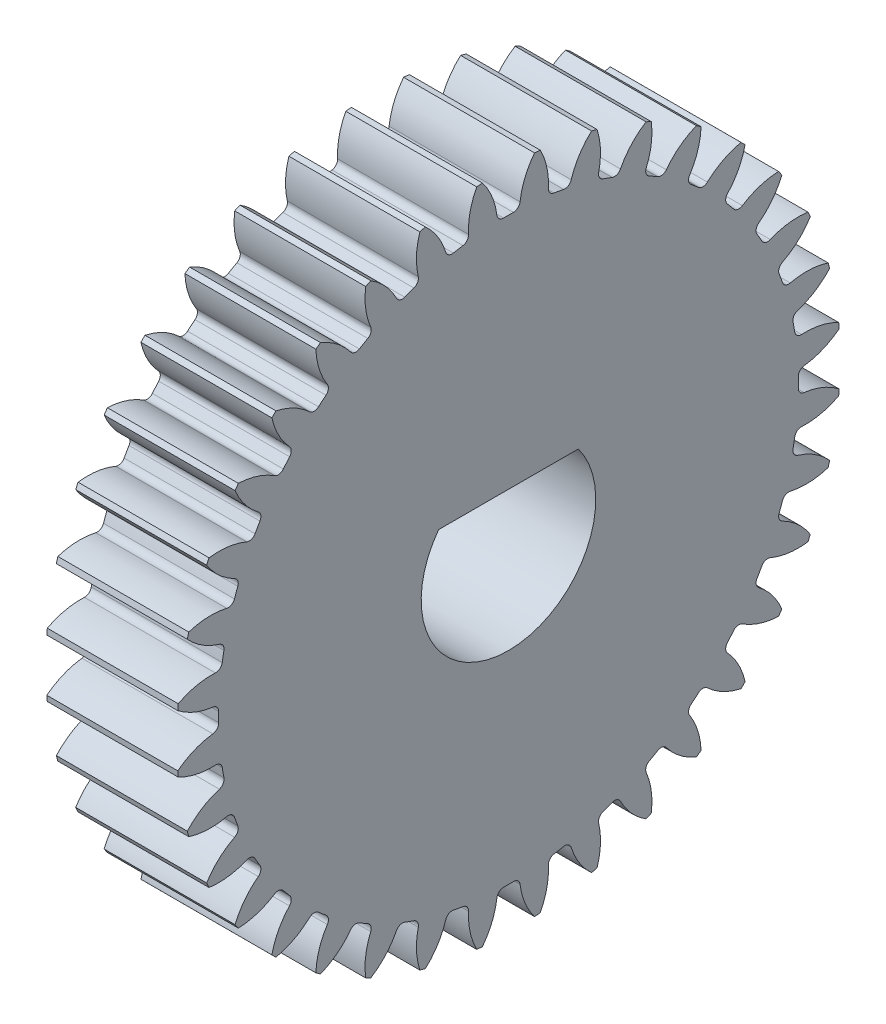
from build123d import *

# Parameters (mm, degrees)
SKETCH1_R                = 19
SKETCH1_R_2              = 5
BOSS_EXTRUDE2_DEPTH      = 7.5
CUT_EXTRUDE1_DEPTH       = 28.897132469
FILLET1_R                = 0.38
CIRPATTERN2_COUNT        = 36
FILLET1_OF_CIRPATTERN2_R = 0.38
BOSS_EXTRUDE3_START      = -7.5
BOSS_EXTRUDE3_DEPTH      = 7.5


with BuildPart() as part:
    # Sketch1 → Boss-Extrude2 (new body)
    with BuildSketch(Plane(origin=(0, 0, 0), x_dir=(0, 0, -1), z_dir=(1, 0, 0))):
        Circle(SKETCH1_R)
        Circle(SKETCH1_R_2, mode=Mode.SUBTRACT)
    extrude(amount=BOSS_EXTRUDE2_DEPTH)

    # Sketch3 → Cut-Extrude1 (cut, through all)
    with BuildSketch(Plane(origin=(7.5, 0, 0), x_dir=(0, 0, -1), z_dir=(1, 0, 0))):
        with BuildLine():
            ThreePointArc((0.63589973, 16.587815755), (0, 16.6), (-0.63589973, 16.587815755))
            ThreePointArc((-0.63589973, 16.587815755), (-0.879876265, 17.831640056), (-1.492494245, 18.941289843))
            ThreePointArc((-1.492494245, 18.941289843), (0, 19), (1.492494245, 18.941289843))
            ThreePointArc((1.492494245, 18.941289843), (0.879876265, 17.831640056), (0.63589973, 16.587815755))
        make_face()
    cut_extrude1 = extrude(amount=-CUT_EXTRUDE1_DEPTH, mode=Mode.SUBTRACT)

    # Fillet1
    fillet1_edges = [part.edges().sort_by_distance(p)[0] for p in [
        (3.75, 16.587815755, 0.63589973),
        (3.75, 16.587815755, -0.63589973),
    ]]
    fillet(fillet1_edges, radius=FILLET1_R)

    # CirPattern2: Cut-Extrude1 ×36 about axis
    cirpattern2_axis = Axis((0, 0, 0), (1, 0, 0))
    for i in range(1, CIRPATTERN2_COUNT):
        add(cut_extrude1.rotate(cirpattern2_axis, i * 360 / CIRPATTERN2_COUNT), mode=Mode.SUBTRACT)

    # Fillet1 of CirPattern2
    fillet1_of_cirpattern2_edges = [part.edges().sort_by_distance(p)[0] for p in [
        (3.75, 16.225386732, 3.506682962),
        (3.75, 16.446232391, 2.254204993),
        (3.75, 15.369957543, 6.270917406),
        (3.75, 15.804938577, 5.075816838),
        (3.75, 14.047519972, 8.844613198),
        (3.75, 14.683419702, 7.743202557),
        (3.75, 12.298255615, 11.149569894),
        (3.75, 13.11575255, 10.175314985),
        (3.75, 10.175314985, 13.11575255),
        (3.75, 11.149569894, 12.298255615),
        (3.75, 7.743202557, 14.683419702),
        (3.75, 8.844613198, 14.047519972),
        (3.75, 5.075816838, 15.804938577),
        (3.75, 6.270917406, 15.369957543),
        (3.75, 2.254204993, 16.446232391),
        (3.75, 3.506682962, 16.225386732),
        (3.75, -0.63589973, 16.587815755),
        (3.75, 0.63589973, 16.587815755),
        (3.75, -3.506682962, 16.225386732),
        (3.75, -2.254204993, 16.446232391),
        (3.75, -6.270917406, 15.369957543),
        (3.75, -5.075816838, 15.804938577),
        (3.75, -8.844613198, 14.047519972),
        (3.75, -7.743202557, 14.683419702),
        (3.75, -11.149569894, 12.298255615),
        (3.75, -10.175314985, 13.11575255),
        (3.75, -13.11575255, 10.175314985),
        (3.75, -12.298255615, 11.149569894),
        (3.75, -14.683419702, 7.743202557),
        (3.75, -14.047519972, 8.844613198),
        (3.75, -15.804938577, 5.075816838),
        (3.75, -15.369957543, 6.270917406),
        (3.75, -16.446232391, 2.254204993),
        (3.75, -16.225386732, 3.506682962),
        (3.75, -16.587815755, -0.63589973),
        (3.75, -16.587815755, 0.63589973),
        (3.75, -16.225386732, -3.506682962),
        (3.75, -16.446232391, -2.254204993),
        (3.75, -15.369957543, -6.270917406),
        (3.75, -15.804938577, -5.075816838),
        (3.75, -14.047519972, -8.844613198),
        (3.75, -14.683419702, -7.743202557),
        (3.75, -12.298255615, -11.149569894),
        (3.75, -13.11575255, -10.175314985),
        (3.75, -10.175314985, -13.11575255),
        (3.75, -11.149569894, -12.298255615),
        (3.75, -7.743202557, -14.683419702),
        (3.75, -8.844613198, -14.047519972),
        (3.75, -5.075816838, -15.804938577),
        (3.75, -6.270917406, -15.369957543),
        (3.75, -2.254204993, -16.446232391),
        (3.75, -3.506682962, -16.225386732),
        (3.75, 0.63589973, -16.587815755),
        (3.75, -0.63589973, -16.587815755),
        (3.75, 3.506682962, -16.225386732),
        (3.75, 2.254204993, -16.446232391),
        (3.75, 6.270917406, -15.369957543),
        (3.75, 5.075816838, -15.804938577),
        (3.75, 8.844613198, -14.047519972),
        (3.75, 7.743202557, -14.683419702),
        (3.75, 11.149569894, -12.298255615),
        (3.75, 10.175314985, -13.11575255),
        (3.75, 13.11575255, -10.175314985),
        (3.75, 12.298255615, -11.149569894),
        (3.75, 14.683419702, -7.743202557),
        (3.75, 14.047519972, -8.844613198),
        (3.75, 15.804938577, -5.075816838),
        (3.75, 15.369957543, -6.270917406),
        (3.75, 16.446232391, -2.254204993),
        (3.75, 16.225386732, -3.506682962),
    ]]
    fillet(fillet1_of_cirpattern2_edges, radius=FILLET1_OF_CIRPATTERN2_R)

    # Sketch4 → Boss-Extrude3 (add)
    with BuildSketch(Plane(origin=(7.5, 0, 0), x_dir=(0, 0, -1), z_dir=(1, 0, 0)).offset(BOSS_EXTRUDE3_START)):
        with BuildLine():
            Line((-4, 3), (4, 3))
            ThreePointArc((4, 3), (0, 5), (-4, 3))
        make_face()
    extrude(amount=BOSS_EXTRUDE3_DEPTH)


solid = part.part
